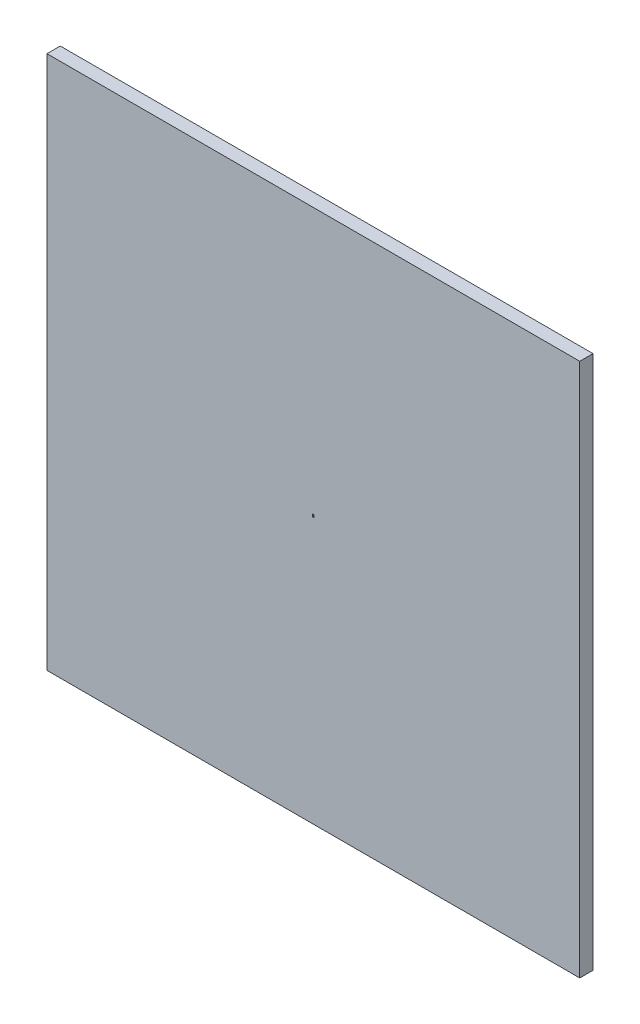
from build123d import *

# Parameters (mm, degrees)
SKETCH_1_W      = 401000
SKETCH_1_H      = 402000
SKETCH_1_W_2    = 1000
SKETCH_1_H_2    = 2000
EXTRUDE_1_DEPTH = 10000


with BuildPart() as part:
    # 草圖1 → 填料-伸長1 (new body)
    with BuildSketch(Plane.XY):
        Rectangle(SKETCH_1_W, SKETCH_1_H)
        Rectangle(SKETCH_1_W_2, SKETCH_1_H_2, mode=Mode.SUBTRACT)
    extrude(amount=EXTRUDE_1_DEPTH)


solid = part.part
